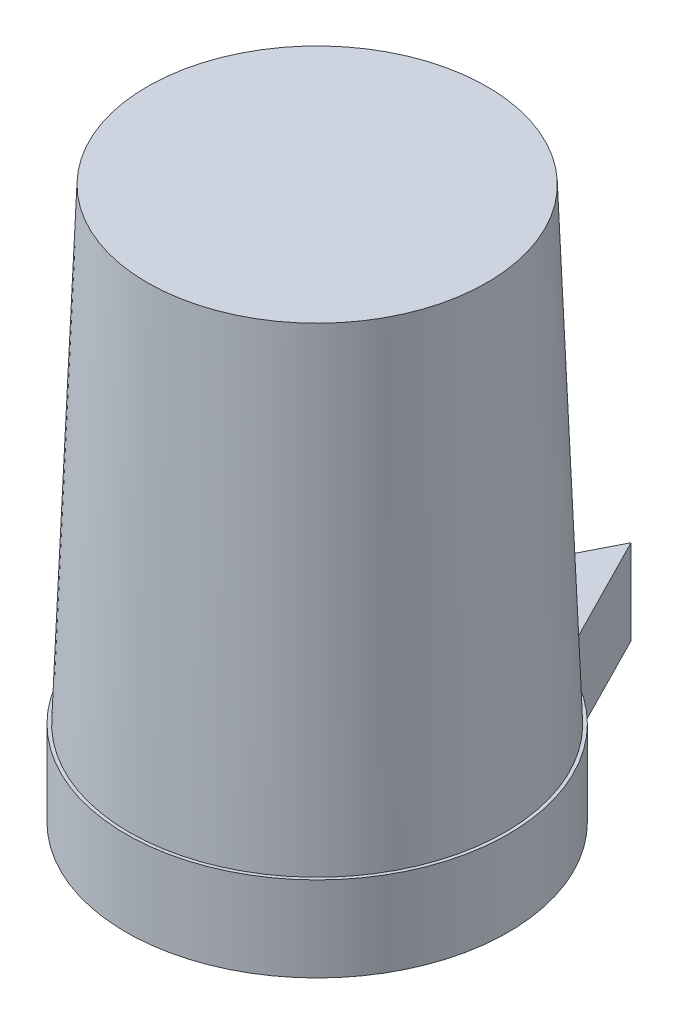
from build123d import *

# Parameters (mm, degrees)
SKETCH2_R           = 4
SKETCH1_R           = 4.5
SKETCH1_35_R        = 3.5
BOSS_EXTRUDE1_DEPTH = 2
CUT_EXTRUDE1_DEPTH  = 10


with BuildPart() as part:
    # Sketch2 → Loft1 section 0
    with BuildSketch(Plane(origin=(0, 13, 0), x_dir=(1, 0, 0), z_dir=(0, 1, 0))):
        Circle(SKETCH2_R)
    # Sketch1 → Loft1 section 1
    with BuildSketch(Plane(origin=(0, 0, 0), x_dir=(1, 0, 0), z_dir=(0, 1, 0))):
        Circle(SKETCH1_R)
    loft()

    # Sketch1<35> → Boss-Extrude1 (add)
    with BuildSketch(Plane(origin=(0, 0, 0), x_dir=(1, 0, 0), z_dir=(0, 1, 0))):
        with BuildLine():
            Line((0, 7.392655237), (-1.626288958, 4.195853218))
            ThreePointArc((-1.626288958, 4.195853218), (0, -4.5), (1.626288958, 4.195853218))
            Line((1.626288958, 4.195853218), (0, 7.392655237))
        make_face()
        Circle(SKETCH1_35_R, mode=Mode.SUBTRACT)
    extrude(amount=BOSS_EXTRUDE1_DEPTH)

    # Sketch1<36> → Cut-Extrude1 (cut)
    with BuildSketch(Plane(origin=(0, 0, 0), x_dir=(1, 0, 0), z_dir=(0, 1, 0))):
        with BuildLine():
            ThreePointArc((3.47706773, 0.4), (0, 3.5), (-3.47706773, 0.4))
            Line((-3.47706773, 0.4), (3.47706773, 0.4))
        make_face()
        with BuildLine():
            Line((3.47706773, -0.4), (-3.47706773, -0.4))
            ThreePointArc((-3.47706773, -0.4), (0, -3.5), (3.47706773, -0.4))
        make_face()
    extrude(amount=CUT_EXTRUDE1_DEPTH, mode=Mode.SUBTRACT)


solid = part.part
